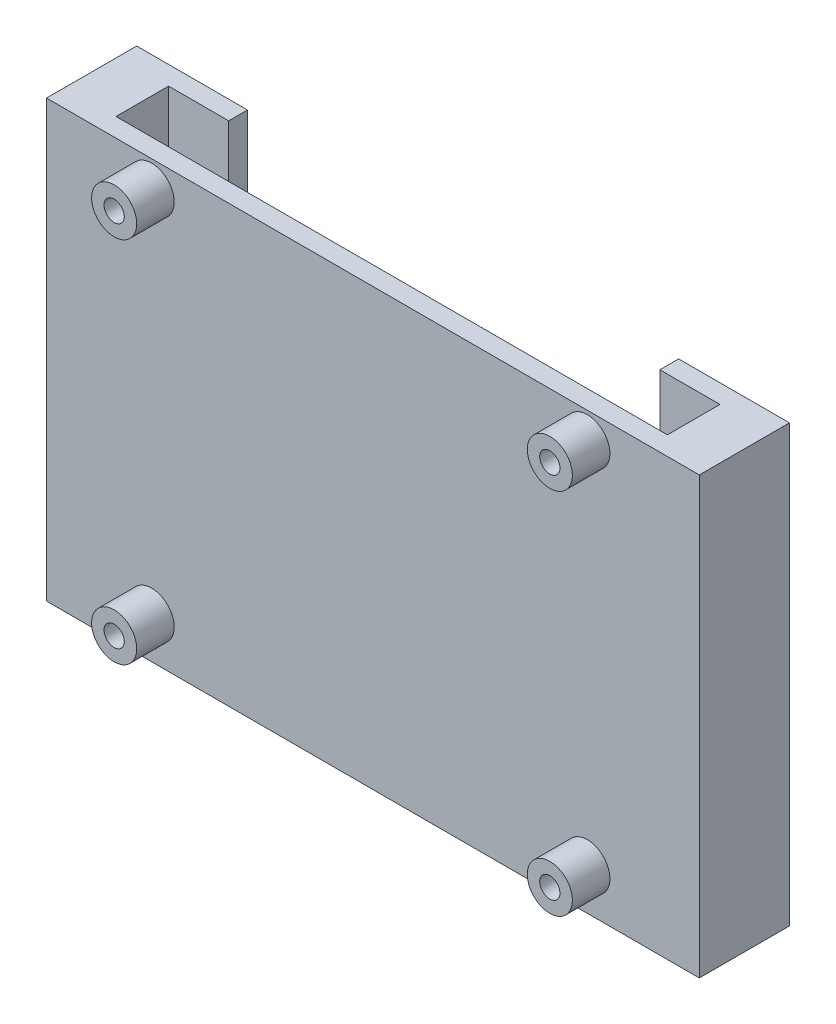
from build123d import *

# Parameters (mm, degrees)
SKETCH1_W              = 86.9
SKETCH1_H              = 58
BOSS_EXTRUDE1_DEPTH    = 2.5
SKETCH2_R              = 3
BOSS_EXTRUDE2_DEPTH    = 5
LPATTERN1_COUNT        = 2
LPATTERN1_PITCH        = 49
M2_5_CLEARANCE_HOLE1_D = 2.7
SKETCH6_W              = 6.75
SKETCH6_H              = 58
BOSS_EXTRUDE3_DEPTH    = 9.5
SKETCH7_W              = 2.5
SKETCH7_H              = 58
BOSS_EXTRUDE4_DEPTH    = 8
SKETCH8_W              = 2.5
SKETCH8_H              = 58
BOSS_EXTRUDE5_DEPTH    = 8
SKETCH9_R              = 3.15
CUT_EXTRUDE1_DEPTH     = 2.7


with BuildPart() as part:
    # Sketch1 → Boss-Extrude1 (new body)
    with BuildSketch(Plane.XY):
        Rectangle(SKETCH1_W, SKETCH1_H)
    extrude(amount=BOSS_EXTRUDE1_DEPTH)

    # Sketch2 → Boss-Extrude2 (add)
    with BuildSketch(Plane.XY.offset(2.5)):
        with Locations(Location((-29.45, 25.5, 0), (0, 0, 180))):
            Circle(SKETCH2_R)
        with Locations(Location((28.55, 25.5, 0), (0, 0, 180))):
            Circle(SKETCH2_R)
    boss_extrude2 = extrude(amount=BOSS_EXTRUDE2_DEPTH)

    # LPattern1: Boss-Extrude2 ×2
    with Locations(*[(0, -i * LPATTERN1_PITCH, 0) for i in range(1, LPATTERN1_COUNT)]):
        add(boss_extrude2)

    # M2.5 Clearance Hole1 (through all)
    with Locations(Plane.XY.offset(7.5)):
        with Locations((-29.45, 25.5), (-29.45, -23.5), (28.55, 25.5), (28.55, -23.5)):
            Hole(M2_5_CLEARANCE_HOLE1_D / 2)

    # Sketch6 → Boss-Extrude3 (add)
    with BuildSketch(Plane(origin=(0, 0, 0), x_dir=(-1, 0, 0), z_dir=(0, 0, -1))):
        with Locations((-40.075, 0)):
            Rectangle(SKETCH6_W, SKETCH6_H)
        with Locations((40.075, 0)):
            Rectangle(SKETCH6_W, SKETCH6_H)
    extrude(amount=BOSS_EXTRUDE3_DEPTH)

    # Sketch7 → Boss-Extrude4 (add)
    with BuildSketch(Plane.ZY.offset(-36.7)):
        with Locations((-8.25, 0)):
            Rectangle(SKETCH7_W, SKETCH7_H)
    extrude(amount=BOSS_EXTRUDE4_DEPTH)

    # Sketch8 → Boss-Extrude5 (add)
    with BuildSketch(Plane(origin=(-36.7, 0, 0), x_dir=(0, 0, -1), z_dir=(1, 0, 0))):
        with Locations((8.25, 0)):
            Rectangle(SKETCH8_W, SKETCH8_H)
    extrude(amount=BOSS_EXTRUDE5_DEPTH)

    # Sketch9 → Cut-Extrude1 (cut)
    with BuildSketch(Plane.XZ.offset(29)):
        with Locations(Location((-40.075, -3.5, 0), (0, 0, 270))):
            Circle(SKETCH9_R)
        with Locations(Location((40.075, -3.5, 0), (0, 0, 270))):
            Circle(SKETCH9_R)
    extrude(amount=-CUT_EXTRUDE1_DEPTH, mode=Mode.SUBTRACT)


solid = part.part
